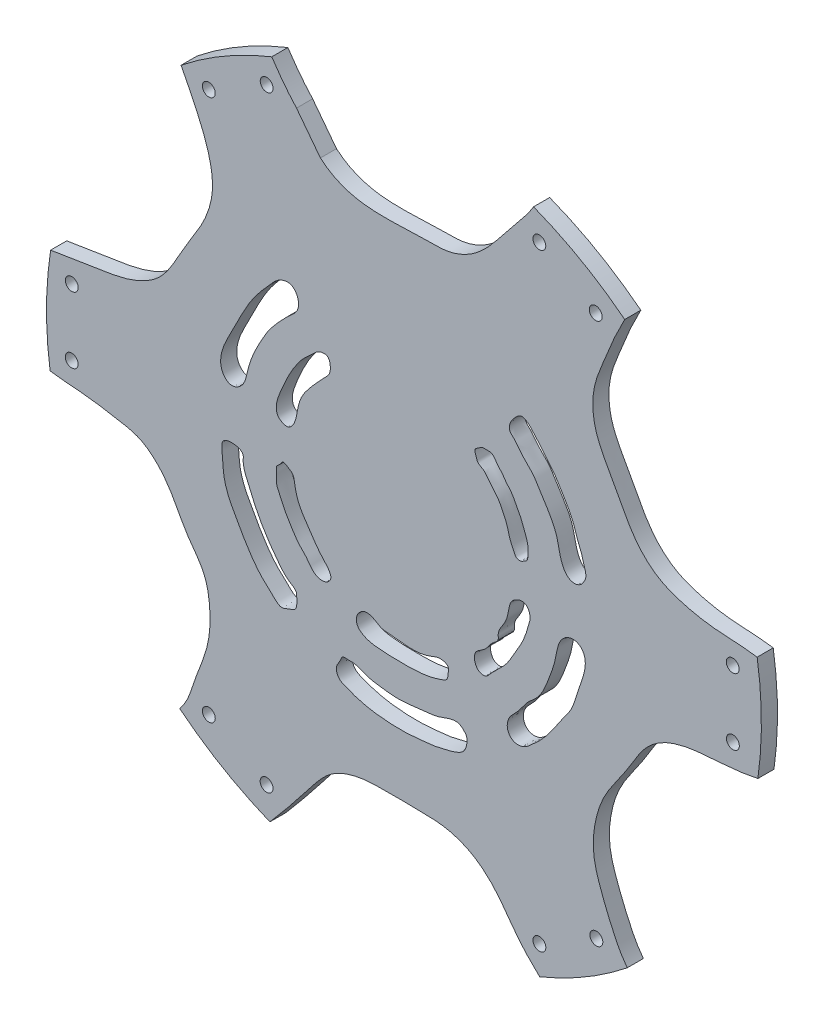
from build123d import *

# Parameters (mm, degrees)
SKETCH1_R           = 222
BOSS_EXTRUDE1_DEPTH = 10
CUT_EXTRUDE14_DEPTH = 10
CUT_EXTRUDE16_DEPTH = 10
CUT_EXTRUDE18_DEPTH = 10
CUT_EXTRUDE19_DEPTH = 10
CUT_EXTRUDE20_DEPTH = 10
CUT_EXTRUDE21_DEPTH = 10
CUT_EXTRUDE22_DEPTH = 10
CUT_EXTRUDE23_DEPTH = 10
CUT_EXTRUDE26_DEPTH = 10
CUT_EXTRUDE27_DEPTH = 10
CUT_EXTRUDE28_DEPTH = 10
CUT_EXTRUDE30_DEPTH = 10
CUT_EXTRUDE32_DEPTH = 10
CUT_EXTRUDE33_DEPTH = 10
CUT_EXTRUDE35_DEPTH = 10
CUT_EXTRUDE37_DEPTH = 10
SKETCH25_R          = 4
CUT_EXTRUDE39_DEPTH = 10
SKETCH26_R          = 4
CUT_EXTRUDE40_DEPTH = 10
SKETCH27_R          = 4
CUT_EXTRUDE41_DEPTH = 10
SKETCH28_R          = 4
CUT_EXTRUDE42_DEPTH = 10
SKETCH29_R          = 4
CUT_EXTRUDE43_DEPTH = 10
SKETCH30_R          = 4
CUT_EXTRUDE44_DEPTH = 10
SKETCH31_R          = 4
CUT_EXTRUDE46_DEPTH = 10
SKETCH32_R          = 4
CUT_EXTRUDE47_DEPTH = 10
SKETCH33_R          = 4
CUT_EXTRUDE49_DEPTH = 10
SKETCH34_R          = 4
CUT_EXTRUDE50_DEPTH = 10
SKETCH35_R          = 4
CUT_EXTRUDE51_DEPTH = 10
SKETCH36_R          = 4
CUT_EXTRUDE52_DEPTH = 10


with BuildPart() as part:
    # Sketch1 → Boss-Extrude1 (new body)
    with BuildSketch(Plane.XY):
        Circle(SKETCH1_R)
    extrude(amount=BOSS_EXTRUDE1_DEPTH)

    # Sketch9 → Cut-Extrude14 (cut)
    with BuildSketch(Plane.XY.offset(10)):
        with BuildLine():
            add(Edge.make_bspline(
                [(-86.149922144, 212.860915174), (-77.881207671, 198.591156543), (-66.721176586, 186.367171231)],
                knots=[0, 0, 0, 1, 1, 1], degree=2))
            Line((-66.721176586, 186.367171231), (-51.884679978, 166.938425673))
            add(Edge.make_bspline(
                [(-51.884679978, 166.938425673), (-44.849308678, 160.787887677), (-31.156783426, 155.540778537), (-8.055568208, 154.559351725), (10.000444846, 155.828014234), (27.762489575, 155.538183397), (40.613390808, 160.596825046), (53.315058011, 171.192427181), (63.875766895, 185.97724204), (116.009874918, 243.733639211), (99.121309768, 350.409780794), (-86.149922144, 212.860915174)],
                knots=[0, 0, 0, 0, 0.079562148, 0.125020754, 0.201324629, 0.238489103, 0.279265935, 0.318866328, 0.381818501, 0.437509713, 1, 1, 1, 1], degree=3))
        make_face()
    extrude(amount=-CUT_EXTRUDE14_DEPTH, mode=Mode.SUBTRACT)

    # Sketch10 → Cut-Extrude16 (cut)
    with BuildSketch(Plane.XY):
        with BuildLine():
            add(Edge.make_bspline(
                [(149.465160634, 191.57997678), (144.06743099, 187.005289132), (137.80300172, 176.30211642), (130.133033222, 160.832238474), (124.21046063, 145.630361366), (118.211304957, 131.974568188), (116.870648126, 118.189303181), (118.485078406, 106.641539795), (123.627830659, 94.517376369), (130.800228805, 82.820550708), (137.301002928, 69.473379619), (145.577781691, 56.129097283), (157.755680536, 45.161937904), (175.041779932, 38.984515343), (192.672014672, 35.792455372), (217.458817449, 35.393281257), (267.40097101, 23.740323706), (269.618209504, 111.792893261), (224.187336274, 148.014941303), (205.424606682, 206.530058037), (161.267429189, 201.582643779), (149.465160634, 191.57997678)],
                knots=[0, 0, 0, 0, 0.043065715, 0.074446345, 0.106598815, 0.143486592, 0.165327122, 0.190938694, 0.214344924, 0.245796101, 0.275283909, 0.305622543, 0.342081045, 0.373289352, 0.417478036, 0.45087144, 0.529831547, 0.677661575, 0.794999476, 0.905835755, 1, 1, 1, 1], degree=3))
        make_face()
    extrude(amount=CUT_EXTRUDE16_DEPTH, mode=Mode.SUBTRACT)

    # Sketch11 → Cut-Extrude18 (cut)
    with BuildSketch(Plane.XY):
        with BuildLine():
            add(Edge.make_bspline(
                [(267.009334964, -28.116401061), (258.380736535, -18.328533), (223.109113175, -32.881483762), (191.172204012, -34.109259046), (166.561344925, -36.824522192), (148.228566857, -49.084971847), (138.515131698, -68.775229168), (124.42131925, -85.532934778), (118.197990831, -105.096260671), (116.554097876, -122.707328116), (122.557415758, -140.728106046), (128.995279262, -156.409260591), (135.595357454, -170.00101208), (159.695474221, -198.579902103), (204.585732496, -130.270659369), (277.627811254, -119.510422908), (276.253691538, -61.739132932), (270.565291606, -32.150107662), (267.009334964, -28.116401061)],
                knots=[0, 0, 0, 0, 0.096595059, 0.15906425, 0.214828907, 0.241442135, 0.290769654, 0.346199804, 0.374036934, 0.415494636, 0.4520133, 0.489121353, 0.519051123, 0.546467516, 0.696834405, 0.836337036, 0.960191931, 1, 1, 1, 1], degree=3))
        make_face()
    extrude(amount=CUT_EXTRUDE18_DEPTH, mode=Mode.SUBTRACT)

    # Sketch12 → Cut-Extrude19 (cut)
    with BuildSketch(Plane.XY):
        with BuildLine():
            add(Edge.make_bspline(
                [(95.464684128, -227.974414306), (98.398446655, -216.206764362), (75.113595609, -199.52858206), (61.75453577, -177.465427799), (45.736233962, -160.489133011), (28.442242431, -154.027978959), (9.121349194, -153.250122919), (-7.619765688, -153.149024552), (-27.799358798, -153.281203044), (-45.780313806, -159.263212897), (-57.942897875, -174.500982255), (-68.862887545, -188.926862954), (-80.587644156, -202.321312398), (-90.984451884, -215.571730573), (-110.190014335, -256.975770799), (-7.547024531, -255.168316537), (40.465405887, -247.818105167), (86.532791147, -245.208882069), (94.795917982, -230.656910191), (95.464684128, -227.974414306)],
                knots=[0, 0, 0, 0, 0.082182361, 0.133318287, 0.175937199, 0.227543207, 0.246617739, 0.299911915, 0.334856307, 0.376214748, 0.415701326, 0.456820657, 0.493292308, 0.528694405, 0.568277696, 0.747688889, 0.901217304, 0.981266111, 1, 1, 1, 1], degree=3))
        make_face()
    extrude(amount=CUT_EXTRUDE19_DEPTH, mode=Mode.SUBTRACT)

    # Sketch13 → Cut-Extrude20 (cut)
    with BuildSketch(Plane.XY):
        with BuildLine():
            add(Edge.make_bspline(
                [(-264.979301073, -31.347976344), (-260.277547102, -21.347214544), (-225.894181419, -32.324358957), (-198.89781949, -33.042283818), (-180.178584426, -36.145981279), (-163.356050916, -39.323721248), (-151.691147845, -48.617020347), (-142.386235631, -62.170786113), (-135.115627677, -77.635799998), (-123.293913766, -91.168002568), (-119.731206828, -110.671048265), (-120.815664831, -131.170964782), (-129.414363774, -149.875244847), (-135.820733464, -173.902193545), (-182.280926366, -204.401756978), (-266.461442348, -209.042115628), (-308.533953872, -115.732357104), (-257.693089717, -76.009950375), (-267.23576167, -36.147530952), (-264.979301073, -31.347976344)],
                knots=[0, 0, 0, 0, 0.082528096, 0.119769885, 0.162164201, 0.183825739, 0.21271707, 0.24052339, 0.273563295, 0.30608807, 0.336415418, 0.379241437, 0.416331891, 0.448782408, 0.511730445, 0.703817077, 0.821502662, 0.960393207, 1, 1, 1, 1], degree=3))
        make_face()
    extrude(amount=CUT_EXTRUDE20_DEPTH, mode=Mode.SUBTRACT)

    # Sketch14 → Cut-Extrude21 (cut)
    with BuildSketch(Plane.XY):
        with BuildLine():
            add(Edge.make_bspline(
                [(-174.212060037, 217.849997433), (-158.711575133, 213.286394889), (-143.518436069, 183.483049524), (-128.769871037, 154.746762024), (-120.74426732, 135.612034814), (-117.461289678, 114.532504738), (-123.903487817, 95.68257858), (-133.806079958, 81.302756555), (-141.852462707, 66.613070803), (-150.887925719, 51.276697203), (-169.838688603, 41.289287727), (-193.494937435, 37.769192867), (-225.440772782, 32.417658146), (-284.667211392, 24.873186436), (-277.922331389, 105.234503641), (-283.26961118, 173.493198396), (-224.344925101, 200.1296327), (-189.496932338, 222.350120013), (-174.212060037, 217.849997433)],
                knots=[0, 0, 0, 0, 0.10257232, 0.139206416, 0.181222557, 0.213226559, 0.25226691, 0.284973193, 0.307584122, 0.343120601, 0.378718509, 0.41887342, 0.470526736, 0.564607798, 0.663122208, 0.818981115, 0.898854467, 1, 1, 1, 1], degree=3))
        make_face()
    extrude(amount=CUT_EXTRUDE21_DEPTH, mode=Mode.SUBTRACT)

    # Sketch15 → Cut-Extrude22 (cut)
    with BuildSketch(Plane.XY):
        with BuildLine():
            add(Edge.make_bspline(
                [(72.471406601, 90.399750299), (75.144478881, 91.151772393), (81.197967115, 84.945113444), (86.644447149, 77.904959462), (93.834608748, 69.91881816), (98.621035114, 61.482526866), (103.598866184, 53.492133318), (106.185070988, 46.739260625), (108.119377777, 40.386230757), (110.604832934, 34.904937265), (112.043411275, 29.25872379), (113.408018225, 24.349279357), (111.964007311, 20.946129969), (109.923776553, 17.940132632), (105.827650407, 16.45969701), (101.16936982, 18.344294636), (98.216682148, 23.209524264), (96.334033032, 29.726839174), (95.220520123, 36.772421126), (92.321035182, 43.432176086), (88.632727257, 49.742474244), (84.290691992, 56.406380703), (79.647986983, 64.277343678), (73.008083003, 69.589501046), (69.349453773, 75.653879267), (64.724780019, 79.048918113), (66.054805805, 84.252083378), (68.675965297, 87.531552507), (71.222171363, 90.048299833), (72.471406601, 90.399750299)],
                knots=[0, 0, 0, 0, 0.051877646, 0.106561485, 0.163712631, 0.225316317, 0.268454818, 0.31978532, 0.344862523, 0.378942974, 0.419092078, 0.443123933, 0.459965294, 0.478545785, 0.502550923, 0.525489843, 0.556307308, 0.593208359, 0.638551573, 0.674106448, 0.713170021, 0.760003031, 0.806506034, 0.864204734, 0.897291594, 0.926307288, 0.948098526, 0.975755469, 1, 1, 1, 1], degree=3))
        make_face()
    extrude(amount=CUT_EXTRUDE22_DEPTH, mode=Mode.SUBTRACT)

    # Sketch16 → Cut-Extrude23 (cut)
    with BuildSketch(Plane.XY):
        with BuildLine():
            add(Edge.make_bspline(
                [(53.498550505, 61.564163924), (55.810623358, 61.296834346), (57.582311866, 56.691987334), (61.260049605, 53.932419922), (62.736746932, 51.035725236), (64.981215388, 48.510254358), (67.375299312, 45.784644425), (69.18355681, 42.199036548), (70.777357472, 38.782094544), (73.054803221, 35.165850202), (74.013510669, 31.394457723), (75.681885937, 27.915531819), (76.57527379, 24.790923843), (77.364911895, 21.165104525), (77.008475233, 17.877221515), (76.839351306, 14.415268169), (74.741365112, 13.557189096), (73.363104888, 12.494728446), (71.445091598, 12.081906221), (69.140321105, 13.012217237), (68.247418632, 15.541370535), (66.743336761, 18.386931364), (65.402000108, 21.883838962), (64.502006014, 26.089287979), (62.944019451, 30.621669972), (60.706262947, 34.948432901), (58.419372614, 39.247331916), (55.275225966, 42.847060662), (52.194778582, 46.304848401), (49.701514377, 50.201052446), (45.64571318, 51.443720469), (44.952288178, 54.999694854), (43.266243143, 58.342614007), (46.518909281, 60.164206077), (48.951420717, 61.97886185), (51.537212384, 61.461669322), (53.062620615, 61.614567592), (53.498550505, 61.564163924)],
                knots=[0, 0, 0, 0, 0.05895527, 0.089619362, 0.112126988, 0.135042641, 0.170630323, 0.198486248, 0.230798418, 0.261138441, 0.300170307, 0.32308596, 0.353323999, 0.378179514, 0.410434274, 0.435782026, 0.450275157, 0.460761711, 0.477765499, 0.494696466, 0.515102224, 0.538471696, 0.572948365, 0.603953068, 0.641566288, 0.687303138, 0.720668832, 0.757819305, 0.801227597, 0.831972171, 0.867123178, 0.888591208, 0.916930855, 0.94056321, 0.964429682, 0.988884276, 1, 1, 1, 1], degree=3))
        make_face()
    extrude(amount=CUT_EXTRUDE23_DEPTH, mode=Mode.SUBTRACT)

    # Sketch17 → Cut-Extrude26 (cut)
    with BuildSketch(Plane.XY.offset(10)):
        with BuildLine():
            add(Edge.make_bspline(
                [(-75.207667067, 89.512431574), (-78.900211526, 88.331022771), (-84.184084983, 81.975929237), (-92.699127139, 72.639810205), (-100.209282991, 59.918765672), (-106.731009037, 46.236881516), (-113.239544075, 34.465095216), (-114.453182547, 24.452744186), (-111.366193823, 18.737972008), (-106.153016145, 16.037804474), (-98.86260738, 20.523133374), (-97.275267347, 29.892067322), (-94.319038543, 39.549256439), (-89.484978298, 48.922112234), (-84.60647169, 57.947875172), (-77.874191158, 65.685625441), (-71.937193368, 72.059442289), (-65.403469677, 77.222267703), (-65.158446762, 84.527565331), (-69.055962062, 90.373794097), (-73.466125189, 90.06962809), (-75.207667067, 89.512431574)],
                knots=[0, 0, 0, 0, 0.062479093, 0.1294378, 0.211766648, 0.304383042, 0.38068734, 0.434228427, 0.461867198, 0.483153872, 0.523930344, 0.578255931, 0.635586945, 0.69148634, 0.752127943, 0.804921729, 0.859721314, 0.898786652, 0.934877878, 0.970532526, 1, 1, 1, 1], degree=3))
        make_face()
    extrude(amount=-CUT_EXTRUDE26_DEPTH, mode=Mode.SUBTRACT)

    # Sketch18 → Cut-Extrude27 (cut)
    with BuildSketch(Plane.XY.offset(10)):
        with BuildLine():
            add(Edge.make_bspline(
                [(-52.529558055, 62.34742017), (-54.40126662, 61.566856761), (-57.428233462, 58.352015519), (-62.7416638, 53.816652174), (-67.064782946, 48.00515928), (-70.894642923, 41.78957669), (-73.977321368, 35.321839641), (-77.211108236, 27.861542217), (-79.712717669, 21.241540239), (-78.794686098, 14.023052562), (-71.53944467, 10.442876304), (-67.440479118, 16.929980901), (-66.24242164, 23.320864904), (-64.639014955, 32.182225725), (-58.786543167, 39.796769353), (-53.259017201, 45.951329992), (-49.295224005, 50.105761425), (-45.832115575, 53.502857326), (-45.516090709, 58.064180559), (-46.741190818, 63.492069447), (-50.84111671, 63.051555182), (-52.529558055, 62.34742017)],
                knots=[0, 0, 0, 0, 0.04469885, 0.105713595, 0.163813376, 0.215135941, 0.278266384, 0.332697087, 0.408391346, 0.44151817, 0.497861151, 0.544064379, 0.593585263, 0.657489713, 0.751832173, 0.815005102, 0.853152715, 0.889362781, 0.92381791, 0.959677811, 1, 1, 1, 1], degree=3))
        make_face()
    extrude(amount=-CUT_EXTRUDE27_DEPTH, mode=Mode.SUBTRACT)

    # Sketch19 → Cut-Extrude28 (cut)
    with BuildSketch(Plane.XY.offset(10)):
        with BuildLine():
            add(Edge.make_bspline(
                [(-99.823771195, -19.219361406), (-99.999603964, -23.289533686), (-96.661933692, -30.290404408), (-92.307701792, -41.116552193), (-86.308270853, -52.123368276), (-78.924083748, -62.473674806), (-72.781119882, -70.037796122), (-66.399409633, -73.244757987), (-66.613093984, -76.977843593), (-66.414102107, -80.024331216), (-66.98725511, -84.2879673), (-71.628720735, -85.141153141), (-76.795705608, -88.251320901), (-82.456605493, -81.846484845), (-89.476624667, -75.993985477), (-96.874561493, -65.787835577), (-103.985122144, -53.316220747), (-111.99788588, -38.626749787), (-112.553857782, -26.366676666), (-113.586736891, -14.698222468), (-106.278747344, -13.035681944), (-99.341096242, -14.909129595), (-99.791916216, -18.481983193), (-99.823771195, -19.219361406)],
                knots=[0, 0, 0, 0, 0.064422291, 0.123492614, 0.192449336, 0.269258371, 0.330076702, 0.356219117, 0.371914207, 0.386021178, 0.408868573, 0.431521261, 0.456060318, 0.499475795, 0.544468819, 0.615070359, 0.699658512, 0.783976006, 0.878995204, 0.915514688, 0.944482239, 0.988328849, 1, 1, 1, 1], degree=3))
        make_face()
    extrude(amount=-CUT_EXTRUDE28_DEPTH, mode=Mode.SUBTRACT)

    # Sketch20 → Cut-Extrude30 (cut)
    with BuildSketch(Plane.XY):
        with BuildLine():
            add(Edge.make_bspline(
                [(-79.117488337, -14.805376794), (-78.834102128, -17.412523906), (-79.898134054, -21.700406537), (-76.58949848, -27.660796108), (-74.195580863, -33.657205966), (-70.203012209, -39.988131662), (-65.989453229, -47.02027005), (-59.929513968, -52.372377531), (-56.265995217, -58.74159755), (-50.451792226, -60.383045503), (-46.659759472, -58.685200176), (-44.754658946, -55.4681588), (-46.607361401, -51.696656815), (-49.849849187, -48.219241575), (-53.730534618, -43.878331407), (-57.32869807, -38.153187943), (-61.93129338, -31.91656281), (-66.190416923, -24.481699761), (-67.745616483, -17.478186949), (-68.509392804, -11.542259713), (-71.736506365, -9.712607015), (-75.368609545, -7.146879098), (-76.847346563, -10.805018215), (-79.586640752, -12.164359296), (-79.207440881, -13.977815291), (-79.117488337, -14.805376794)],
                knots=[0, 0, 0, 0, 0.056485695, 0.101933172, 0.151272458, 0.208317396, 0.275452122, 0.340821831, 0.395470687, 0.440696576, 0.465556878, 0.488022737, 0.519207031, 0.552953485, 0.601280617, 0.653500411, 0.710199126, 0.782392645, 0.848926117, 0.881558678, 0.910260215, 0.936397031, 0.961785143, 0.982070292, 1, 1, 1, 1], degree=3))
        make_face()
    extrude(amount=CUT_EXTRUDE30_DEPTH, mode=Mode.SUBTRACT)

    # Sketch21 → Cut-Extrude32 (cut)
    with BuildSketch(Plane.XY):
        with BuildLine():
            add(Edge.make_bspline(
                [(-29.005436552, -72.678954664), (-28.091829455, -74.716534016), (-23.230711655, -77.898944179), (-15.659337162, -78.872128576), (-5.760151011, -79.353197696), (4.744625234, -79.42740914), (15.323607476, -78.592489724), (22.005377335, -76.475222054), (27.366039509, -74.66098172), (27.214069061, -70.715481247), (28.521136582, -66.290038721), (22.236185605, -64.380341485), (17.851269252, -66.405392181), (12.418568984, -68.273153617), (5.834436837, -69.043549931), (-1.987185716, -68.399693032), (-8.365381781, -67.614053445), (-14.361854283, -67.289723872), (-18.362316882, -64.119630921), (-23.533534125, -62.439728106), (-27.285097602, -64.760772606), (-29.721758097, -67.927367749), (-29.732972086, -71.056362865), (-29.005436552, -72.678954664)],
                knots=[0, 0, 0, 0, 0.051215717, 0.120129059, 0.176687358, 0.27864928, 0.363877385, 0.414513283, 0.448952097, 0.474487786, 0.498069691, 0.544417774, 0.578677497, 0.613400934, 0.675078809, 0.730070946, 0.793129693, 0.824853574, 0.864163704, 0.909082859, 0.937879353, 0.959215231, 1, 1, 1, 1], degree=3))
        make_face()
    extrude(amount=CUT_EXTRUDE32_DEPTH, mode=Mode.SUBTRACT)

    # Sketch22 → Cut-Extrude33 (cut)
    with BuildSketch(Plane.XY.offset(10)):
        with BuildLine():
            add(Edge.make_bspline(
                [(-31.956851892, -94.33375733), (-29.041976555, -94.457408754), (-23.139433388, -97.790430469), (-14.13058624, -98.804027773), (-4.945387746, -100.122792834), (4.565168491, -99.26007366), (13.500403038, -98.206227713), (22.123234025, -97.198440854), (28.052712764, -94.235807031), (34.06965762, -93.638571321), (36.929601904, -96.120646066), (39.39347404, -98.810774604), (39.169679198, -103.132396492), (37.55092062, -108.125262405), (31.661786718, -111.073513502), (24.898303321, -112.592656444), (18.095519525, -114.243441537), (11.587309406, -114.693554427), (2.579333636, -115.820882411), (-10.228998393, -115.63653662), (-24.101428572, -113.936291994), (-34.118228489, -110.475026753), (-41.159700897, -107.665033367), (-42.692907029, -101.320542833), (-39.586241229, -98.024464122), (-38.453995214, -93.682017987), (-34.810892587, -94.529229618), (-32.938458268, -94.292116776), (-31.956851892, -94.33375733)],
                knots=[0, 0, 0, 0, 0.049537118, 0.103338145, 0.148986068, 0.200960044, 0.258785334, 0.297333052, 0.341293982, 0.368170538, 0.388748345, 0.400616891, 0.426632784, 0.453652767, 0.483222643, 0.527524173, 0.569146712, 0.597088716, 0.634344722, 0.717754724, 0.806749523, 0.860382659, 0.894079667, 0.92443783, 0.947662815, 0.968489555, 0.983318, 1, 1, 1, 1], degree=3))
        make_face()
    extrude(amount=-CUT_EXTRUDE33_DEPTH, mode=Mode.SUBTRACT)

    # Sketch23 → Cut-Extrude35 (cut)
    with BuildSketch(Plane.XY):
        with BuildLine():
            add(Edge.make_bspline(
                [(58.548417091, -34.523188558), (58.513264912, -30.818343911), (63.65961165, -25.942483606), (64.841475301, -18.310336201), (66.042678406, -12.522737423), (69.947498691, -9.253800552), (75.63239479, -8.101139197), (79.24673361, -14.170712625), (77.450792503, -19.675084373), (75.783735326, -25.235211566), (73.643357727, -31.00671301), (69.157577584, -37.928900175), (65.059088014, -46.152214114), (58.880641659, -52.71482811), (54.146251831, -56.923371203), (50.888426595, -61.097759475), (46.355540086, -60.344134895), (43.60505007, -56.31570248), (43.502043194, -49.887788047), (48.870226133, -47.622183953), (52.241584111, -44.099019522), (54.509207024, -40.241260976), (59.000137654, -37.908121004), (58.555418201, -35.261066695), (58.548417091, -34.523188558)],
                knots=[0, 0, 0, 0, 0.083885455, 0.141521917, 0.178509338, 0.215356742, 0.254516392, 0.293144439, 0.351168227, 0.382286247, 0.428134597, 0.492144876, 0.572054025, 0.639114103, 0.696870018, 0.721844592, 0.753620108, 0.784066437, 0.830512185, 0.878057827, 0.904310516, 0.942580057, 0.983292891, 1, 1, 1, 1], degree=3))
        make_face()
    extrude(amount=CUT_EXTRUDE35_DEPTH, mode=Mode.SUBTRACT)

    # Sketch24 → Cut-Extrude37 (cut)
    with BuildSketch(Plane.XY):
        with BuildLine():
            add(Edge.make_bspline(
                [(81.736470989, -56.971432691), (85.841118078, -52.964764306), (89.758925615, -42.906381564), (94.477682511, -30.194902761), (95.43952438, -19.889170302), (100.70320195, -13.780999916), (107.318860262, -12.903411489), (112.297091131, -17.376297381), (113.153506171, -25.390774825), (109.871568396, -34.203997166), (106.856255456, -43.873585469), (103.680391643, -53.25862207), (97.550536428, -60.417264596), (92.188961725, -69.122606286), (85.9819728, -77.017969762), (79.420669789, -82.938154135), (74.110030184, -87.458149252), (67.687853252, -87.546348584), (63.657107813, -82.544868556), (64.444338823, -75.11394869), (71.728179257, -69.275875424), (75.90227911, -61.630072267), (80.499478699, -58.178897741), (81.736470989, -56.971432691)],
                knots=[0, 0, 0, 0, 0.09373547, 0.166972289, 0.223142366, 0.256840769, 0.290246455, 0.319330048, 0.355403806, 0.413718545, 0.470831447, 0.521034824, 0.572684585, 0.622161319, 0.687570671, 0.734605097, 0.766564607, 0.798715608, 0.826237674, 0.86065698, 0.907899754, 0.971751517, 1, 1, 1, 1], degree=3))
        make_face()
    extrude(amount=CUT_EXTRUDE37_DEPTH, mode=Mode.SUBTRACT)

    # Sketch25 → Cut-Extrude39 (cut)
    with BuildSketch(Plane.XY):
        with Locations((-121.210550842, 169.090260277)):
            Circle(SKETCH25_R)
    extrude(amount=CUT_EXTRUDE39_DEPTH, mode=Mode.SUBTRACT)

    # Sketch26 → Cut-Extrude40 (cut)
    with BuildSketch(Plane.XY.offset(10)):
        with Locations((-85.253720212, 189.644479942)):
            Circle(SKETCH26_R)
    extrude(amount=-CUT_EXTRUDE40_DEPTH, mode=Mode.SUBTRACT)

    # Sketch27 → Cut-Extrude41 (cut)
    with BuildSketch(Plane.XY.offset(10)):
        with Locations((119.134180138, 169.019850687)):
            Circle(SKETCH27_R)
    extrude(amount=-CUT_EXTRUDE41_DEPTH, mode=Mode.SUBTRACT)

    # Sketch28 → Cut-Extrude42 (cut)
    with BuildSketch(Plane.XY.offset(10)):
        with Locations((84.095888722, 189.590152191)):
            Circle(SKETCH28_R)
    extrude(amount=-CUT_EXTRUDE42_DEPTH, mode=Mode.SUBTRACT)

    # Sketch29 → Cut-Extrude43 (cut)
    with BuildSketch(Plane.XY.offset(10)):
        with Locations((204.192556652, 22.03508648)):
            Circle(SKETCH29_R)
    extrude(amount=-CUT_EXTRUDE43_DEPTH, mode=Mode.SUBTRACT)

    # Sketch30 → Cut-Extrude44 (cut)
    with BuildSketch(Plane.XY.offset(10)):
        with Locations((204.293748466, -19.184727282)):
            Circle(SKETCH30_R)
    extrude(amount=-CUT_EXTRUDE44_DEPTH, mode=Mode.SUBTRACT)

    # Sketch31 → Cut-Extrude46 (cut)
    with BuildSketch(Plane.XY):
        with Locations((119.514458492, -167.184244585)):
            Circle(SKETCH31_R)
    extrude(amount=CUT_EXTRUDE46_DEPTH, mode=Mode.SUBTRACT)

    # Sketch32 → Cut-Extrude47 (cut)
    with BuildSketch(Plane.XY.offset(10)):
        with Locations((84.130444904, -187.711679639)):
            Circle(SKETCH32_R)
    extrude(amount=-CUT_EXTRUDE47_DEPTH, mode=Mode.SUBTRACT)

    # Sketch33 → Cut-Extrude49 (cut)
    with BuildSketch(Plane.XY):
        with Locations((-85.304062549, -186.893038228)):
            Circle(SKETCH33_R)
    extrude(amount=CUT_EXTRUDE49_DEPTH, mode=Mode.SUBTRACT)

    # Sketch34 → Cut-Extrude50 (cut)
    with BuildSketch(Plane.XY.offset(10)):
        with Locations((-121.182747734, -167.096447587)):
            Circle(SKETCH34_R)
    extrude(amount=-CUT_EXTRUDE50_DEPTH, mode=Mode.SUBTRACT)

    # Sketch35 → Cut-Extrude51 (cut)
    with BuildSketch(Plane.XY.offset(10)):
        with Locations((-206.340877074, -19.208223374)):
            Circle(SKETCH35_R)
    extrude(amount=-CUT_EXTRUDE51_DEPTH, mode=Mode.SUBTRACT)

    # Sketch36 → Cut-Extrude52 (cut)
    with BuildSketch(Plane.XY.offset(10)):
        with Locations((-206.299388784, 21.958000879)):
            Circle(SKETCH36_R)
    extrude(amount=-CUT_EXTRUDE52_DEPTH, mode=Mode.SUBTRACT)


solid = part.part
